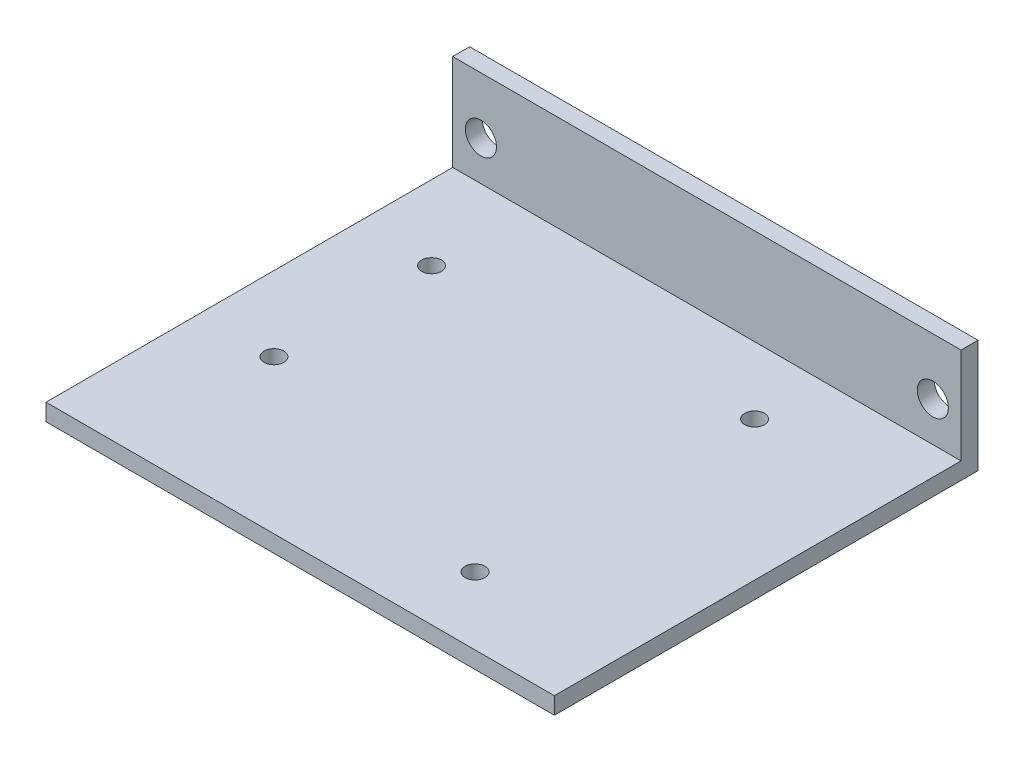
from build123d import *

# Parameters (mm, degrees)
SKETCH1_W            = 90
SKETCH1_H            = 75
BOSS_EXTRUDE1_DEPTH  = 3
SKETCH2_W            = 90
SKETCH2_H            = 3
BOSS_EXTRUDE2_DEPTH  = 17
M5_CLEARANCE_HOLE1_D = 5.5
CUT_EXTRUDE1_REACH   = 62.994
SKETCH5_R            = 1.75


with BuildPart() as part:
    # Sketch1 → Boss-Extrude1 (new body)
    with BuildSketch(Plane(origin=(0, 0, 0), x_dir=(1, 0, 0), z_dir=(0, 1, 0))):
        Rectangle(SKETCH1_W, SKETCH1_H)
    extrude(amount=BOSS_EXTRUDE1_DEPTH)

    # Sketch2 → Boss-Extrude2 (add)
    with BuildSketch(Plane(origin=(0, 3, 0), x_dir=(1, 0, 0), z_dir=(0, 1, 0))):
        with Locations((0, 36)):
            Rectangle(SKETCH2_W, SKETCH2_H)
    extrude(amount=BOSS_EXTRUDE2_DEPTH)

    # M5 Clearance Hole1 (through all)
    with Locations(Plane(origin=(40, 10, -37.5), x_dir=(-1, 0, 0), z_dir=(0, 0, -1))):
        with Locations((0, 0), (80, 0)):
            Hole(M5_CLEARANCE_HOLE1_D / 2)

    # Sketch5 → Cut-Extrude1 (cut, up to next)
    with BuildSketch(Plane(origin=(0, 3, 0), x_dir=(1, 0, 0), z_dir=(0, 1, 0)), mode=Mode.PRIVATE) as cut_extrude1_sk1:
        with Locations(Location((-31.8, 17.55, 0), (0, 0, 270))):
            Circle(SKETCH5_R)
    cut_extrude1_tool1 = extrude(cut_extrude1_sk1.sketch, amount=-CUT_EXTRUDE1_REACH, mode=Mode.PRIVATE) & part.part
    # Sketch5 → Cut-Extrude1 (cut, up to next)
    with BuildSketch(Plane(origin=(0, 3, 0), x_dir=(1, 0, 0), z_dir=(0, 1, 0)), mode=Mode.PRIVATE) as cut_extrude1_sk2:
        with Locations(Location((-31.8, -10.35, 0), (0, 0, 270))):
            Circle(SKETCH5_R)
    cut_extrude1_tool2 = extrude(cut_extrude1_sk2.sketch, amount=-CUT_EXTRUDE1_REACH, mode=Mode.PRIVATE) & part.part
    # Sketch5 → Cut-Extrude1 (cut, up to next)
    with BuildSketch(Plane(origin=(0, 3, 0), x_dir=(1, 0, 0), z_dir=(0, 1, 0)), mode=Mode.PRIVATE) as cut_extrude1_sk3:
        with Locations(Location((19, -25.55, 0), (0, 0, 270))):
            Circle(SKETCH5_R)
    cut_extrude1_tool3 = extrude(cut_extrude1_sk3.sketch, amount=-CUT_EXTRUDE1_REACH, mode=Mode.PRIVATE) & part.part
    # Sketch5 → Cut-Extrude1 (cut, up to next)
    with BuildSketch(Plane(origin=(0, 3, 0), x_dir=(1, 0, 0), z_dir=(0, 1, 0)), mode=Mode.PRIVATE) as cut_extrude1_sk4:
        with Locations(Location((20.3, 22.65, 0), (0, 0, 270))):
            Circle(SKETCH5_R)
    cut_extrude1_tool4 = extrude(cut_extrude1_sk4.sketch, amount=-CUT_EXTRUDE1_REACH, mode=Mode.PRIVATE) & part.part
    add(cut_extrude1_tool1.solids().sort_by_distance((-31.8, 3, -17.55))[0], mode=Mode.SUBTRACT)
    add(cut_extrude1_tool2.solids().sort_by_distance((-31.8, 3, 10.35))[0], mode=Mode.SUBTRACT)
    add(cut_extrude1_tool3.solids().sort_by_distance((19, 3, 25.55))[0], mode=Mode.SUBTRACT)
    add(cut_extrude1_tool4.solids().sort_by_distance((20.3, 3, -22.65))[0], mode=Mode.SUBTRACT)


solid = part.part
